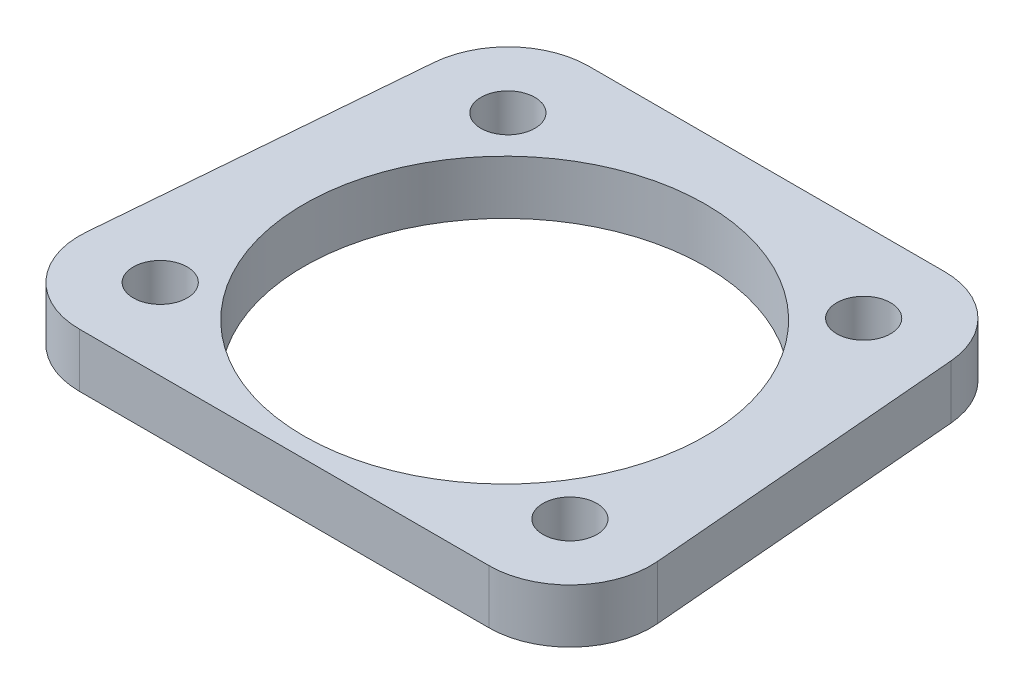
from build123d import *

# Parameters (mm, degrees)
SKETCH1_R           = 5
SKETCH1_R_2         = 37.25
BOSS_EXTRUDE1_DEPTH = 10


with BuildPart() as part:
    # Sketch1 → Boss-Extrude1 (new body)
    with BuildSketch(Plane(origin=(0, 0, 0), x_dir=(1, 0, 0), z_dir=(0, 1, 0))):
        with BuildLine():
            Line((-47.947299322, 31.850398489), (-52.947299322, -27.639852814))
            ThreePointArc((-52.947299322, -27.639852814), (-49.041834565, -39.048862398), (-38, -43.896134221))
            Line((-38, -43.896134221), (38, -43.896134221))
            ThreePointArc((38, -43.896134221), (49.041834565, -39.048862398), (52.947299322, -27.639852814))
            Line((52.947299322, -27.639852814), (47.947299322, 31.850398489))
            ThreePointArc((47.947299322, 31.850398489), (43.152728178, 41.635951646), (33, 45.594117082))
            Line((33, 45.594117082), (-33, 45.594117082))
            ThreePointArc((-33, 45.594117082), (-43.152728178, 41.635951646), (-47.947299322, 31.850398489))
        make_face()
        with Locations(Location((-33, 30.594117082, 0), (0, 0, 270))):
            Circle(SKETCH1_R, mode=Mode.SUBTRACT)
        with Locations(Location((33, 30.594117082, 0), (0, 0, 270))):
            Circle(SKETCH1_R, mode=Mode.SUBTRACT)
        with Locations(Location((38, -28.896134221, 0), (0, 0, 270))):
            Circle(SKETCH1_R, mode=Mode.SUBTRACT)
        with Locations(Location((-38, -28.896134221, 0), (0, 0, 270))):
            Circle(SKETCH1_R, mode=Mode.SUBTRACT)
        with Locations(Location((0, -3, 0), (0, 0, 270))):
            Circle(SKETCH1_R_2, mode=Mode.SUBTRACT)
    extrude(amount=BOSS_EXTRUDE1_DEPTH)


solid = part.part
